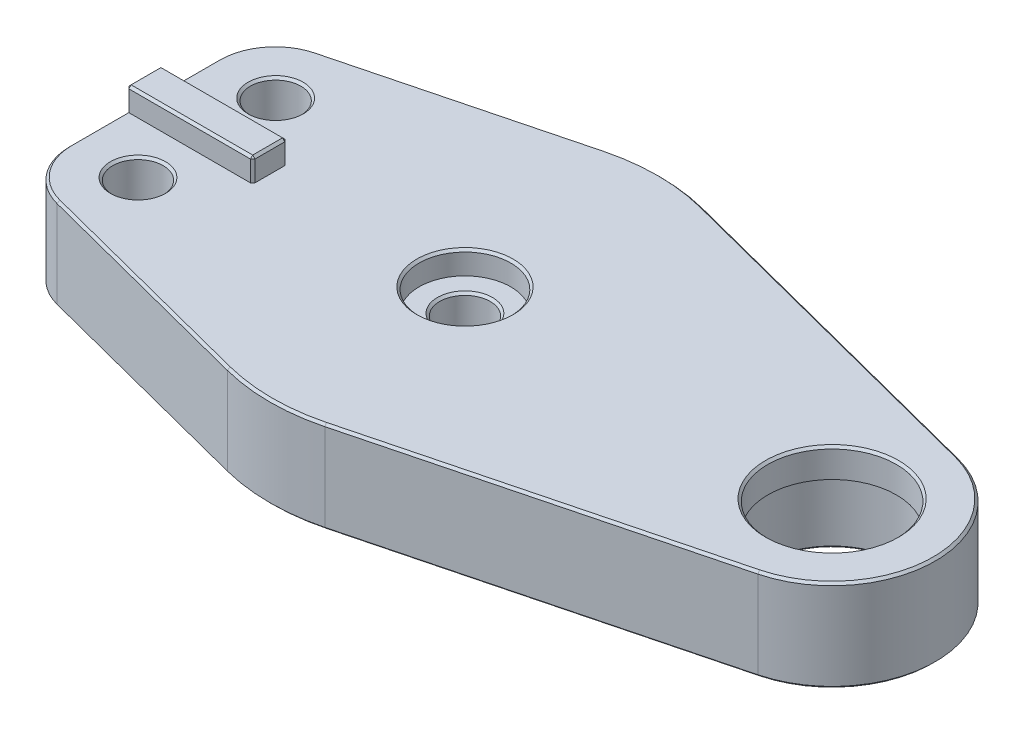
from build123d import *

# Parameters (mm, degrees)
SKETCH_1_R           = 2.1
EXTRUDE_2_DEPTH      = 8
SKETCH_2_R           = 2.2
CUT_EXTRUDE_1_DEPTH  = 20
SKETCH_2_3_R         = 4
SKETCH_2_3_R_2       = 2.2
CUT_EXTRUDE_2_DEPTH  = 2
CUT_EXTRUDE_START    = -8
SKETCH_9_R           = 3
SKETCH_9_R_2         = 2.1
CUT_EXTRUDE_11_DEPTH = 8
SKETCH_10_R          = 5.6
SKETCH_10_R_2        = 3
CUT_EXTRUDE_12_DEPTH = 5.5
SKETCH_10_3_R        = 6
SKETCH_10_3_R_2      = 5.6
CUT_EXTRUDE_13_DEPTH = 5.5
SKETCH_10_4_R        = 5.6
SKETCH_10_4_R_2      = 3
CUT_EXTRUDE_14_DEPTH = 20
CHAMFER_1_SIZE       = 0.2
SKETCH_11_R          = 2.2
EXTRUDE_3_DEPTH      = 8
FILLET_1_R           = 5
SKETCH_12_W          = 11
SKETCH_12_H          = 3
EXTRUDE_5_DEPTH      = 2
CUT_EXTRUDE_START_2  = -2
SKETCH_13_R          = 4
CUT_EXTRUDE_16_DEPTH = 2
CHAMFER_2_SIZE       = 0.2


with BuildPart() as part:
    # 스케치1 → 보스-돌출2 (new body)
    with BuildSketch(Plane(origin=(0, 0, 0), x_dir=(1, 0, 0), z_dir=(0, 1, 0))):
        with BuildLine():
            Line((34.25, 8.714212529), (4.25, 16.460179221))
            ThreePointArc((4.25, 16.460179221), (-17, 0), (4.25, -16.460179221))
            Line((4.25, -16.460179221), (34.25, -8.714212529))
            ThreePointArc((34.25, -8.714212529), (41, 0), (34.25, 8.714212529))
        make_face()
        with Locations(Location((32, 0, 0), (0, 0, 270))):
            Circle(SKETCH_1_R, mode=Mode.SUBTRACT)
    extrude(amount=EXTRUDE_2_DEPTH)

    # 스케치2 → 컷-돌출1 (cut)
    with BuildSketch(Plane(origin=(0, 8, 0), x_dir=(1, 0, 0), z_dir=(0, 1, 0))):
        with Locations(Location((0, 0, 0), (0, 0, 270))):
            Circle(SKETCH_2_R)
    extrude(amount=-CUT_EXTRUDE_1_DEPTH, mode=Mode.SUBTRACT)

    # 스케치2<3> → 컷-돌출2 (cut)
    with BuildSketch(Plane(origin=(0, 8, 0), x_dir=(1, 0, 0), z_dir=(0, 1, 0))):
        with Locations(Location((0, 0, 0), (0, 0, 270))):
            Circle(SKETCH_2_3_R)
        with Locations(Location((0, 0, 0), (0, 0, 270))):
            Circle(SKETCH_2_3_R_2, mode=Mode.SUBTRACT)
    extrude(amount=-CUT_EXTRUDE_2_DEPTH, mode=Mode.SUBTRACT)

    # 스케치9 → 컷-돌출11 (cut)
    with BuildSketch(Plane(origin=(0, 8, 0), x_dir=(1, 0, 0), z_dir=(0, 1, 0)).offset(CUT_EXTRUDE_START)):
        with Locations(Location((32, 0, 0), (0, 0, 270))):
            Circle(SKETCH_9_R)
        with Locations((32, 0)):
            Circle(SKETCH_9_R_2, mode=Mode.SUBTRACT)
    extrude(amount=CUT_EXTRUDE_11_DEPTH, mode=Mode.SUBTRACT)

    # 스케치10 → 컷-돌출12 (cut)
    with BuildSketch(Plane.XZ):
        with Locations(Location((32, 0, 0), (0, 0, 270))):
            Circle(SKETCH_10_R)
        with Locations(Location((32, 0, 0), (0, 0, 90))):
            Circle(SKETCH_10_R_2, mode=Mode.SUBTRACT)
    extrude(amount=-CUT_EXTRUDE_12_DEPTH, mode=Mode.SUBTRACT)

    # 스케치10<3> → 컷-돌출13 (cut)
    with BuildSketch(Plane.XZ):
        with Locations(Location((32, 0, 0), (0, 0, 270))):
            Circle(SKETCH_10_3_R)
        with Locations((32, 0)):
            Circle(SKETCH_10_3_R_2, mode=Mode.SUBTRACT)
    extrude(amount=-CUT_EXTRUDE_13_DEPTH, mode=Mode.SUBTRACT)

    # 스케치10<4> → 컷-돌출14 (cut)
    with BuildSketch(Plane.XZ):
        with Locations(Location((32, 0, 0), (0, 0, 270))):
            Circle(SKETCH_10_4_R)
        with Locations((32, 0)):
            Circle(SKETCH_10_4_R_2, mode=Mode.SUBTRACT)
    extrude(amount=-CUT_EXTRUDE_14_DEPTH, mode=Mode.SUBTRACT)

    # 모따기1
    chamfer_1_edges = [part.edges().sort_by_distance(p)[0] for p in [
        (32, 0, 6),
        (32, 8, 5.6),
    ]]
    chamfer(chamfer_1_edges, length=CHAMFER_1_SIZE)

    # 스케치11 → 보스-돌출3 (add)
    # profile 1 of 3: a face of its own
    with BuildSketch(Plane(origin=(0, 0, 0), x_dir=(1, 0, 0), z_dir=(0, 1, 0))):
        with BuildLine():
            ThreePointArc((-17, 1.7e-08), (-13.43968005, 10.410331414), (-4.25, 16.460179221))
            Line((-4.25, 16.460179221), (-17, 13.168143377))
            Line((-17, 13.168143377), (-17, 1.7e-08))
        make_face()
    # profile 2 of 3: a face of its own
    with BuildSketch(Plane(origin=(0, 0, 0), x_dir=(1, 0, 0), z_dir=(0, 1, 0))):
        with BuildLine():
            ThreePointArc((-4.25, -16.460179221), (-13.439680061, -10.4103314), (-17, 1.7e-08))
            Line((-17, 1.7e-08), (-17, -13.168143377))
            Line((-17, -13.168143377), (-4.25, -16.460179221))
        make_face()
    # profile 3 of 3: a face of its own
    with BuildSketch(Plane(origin=(0, 0, 0), x_dir=(1, 0, 0), z_dir=(0, 1, 0))):
        Polygon((-17, 1.7e-08), (-17, 13.168143377), (-28, 10.32795559), (-28, -10.32795559), (-17, -13.168143377), align=None)
        with Locations(Location((-22.5, -6, 0), (0, 0, 270))):
            Circle(SKETCH_11_R, mode=Mode.SUBTRACT)
        with Locations(Location((-22.5, 6, 0), (0, 0, 270))):
            Circle(SKETCH_11_R, mode=Mode.SUBTRACT)
    extrude(amount=EXTRUDE_3_DEPTH)

    # 필렛1
    fillet_1_edges = [part.edges().sort_by_distance(p)[0] for p in [
        (-28, 4, 10.32795559),
        (-28, 4, -10.32795559),
    ]]
    fillet(fillet_1_edges, radius=FILLET_1_R)

    # 스케치12 → 보스-돌출5 (add)
    with BuildSketch(Plane(origin=(0, 8, 0), x_dir=(1, 0, 0), z_dir=(0, 1, 0))):
        with Locations((-22.5, 0)):
            Rectangle(SKETCH_12_W, SKETCH_12_H)
    extrude(amount=EXTRUDE_5_DEPTH)

    # 스케치13 → 컷-돌출16 (cut)
    with BuildSketch(Plane.XZ.offset(CUT_EXTRUDE_START_2)):
        with Locations(Location((-22.5, 6, 0), (0, 0, 270))):
            Circle(SKETCH_13_R)
        with Locations(Location((-22.5, -6, 0), (0, 0, 270))):
            Circle(SKETCH_13_R)
        with Locations(Location((0, 0, 0), (0, 0, 90))):
            Circle(SKETCH_13_R)
    extrude(amount=CUT_EXTRUDE_16_DEPTH, mode=Mode.SUBTRACT)

    # 모따기2
    chamfer_2_edges = [part.edges().sort_by_distance(p)[0] for p in [
        (-28, 8, -3.977486122),
        (-26.952847075, 8, -9.516834422),
        (-26.952847075, 8, 9.516834422),
        (19.25, 8, -12.587195875),
        (-28, 8, 3.977486122),
        (-17, 9, 1.5),
        (-17, 9, -1.5),
        (-28, 9, -1.5),
        (-28, 9, 1.5),
        (-17, 10, 0),
        (-22.5, 10, -1.5),
        (-28, 10, 0),
        (-22.5, 10, 1.5),
        (0, 0, -4),
        (0, 2, -2.2),
        (-22.5, 2, -8.2),
        (-22.5, 0, -2),
        (-22.5, 2, 3.8),
        (-22.5, 0, 10),
        (0, 8, -17),
        (19.25, 8, 12.587195875),
        (0, 6, -2.2),
        (0, 8, -4),
        (41, 8, 0),
        (19.25, 0, 12.587195875),
        (0, 0, -17),
        (0, 0, 17),
        (0, 8, 17),
        (-22.5, 8, 3.8),
        (-14.25, 0, -13.878190324),
        (19.25, 0, -12.587195875),
        (-22.5, 8, -8.2),
        (-14.25, 8, -13.878190324),
        (41, 0, 0),
        (-14.25, 8, 13.878190324),
        (-14.25, 0, 13.878190324),
        (-28, 0, 0),
        (-26.952847075, 0, -9.516834422),
        (-26.952847075, 0, 9.516834422),
    ]]
    chamfer(chamfer_2_edges, length=CHAMFER_2_SIZE)


solid = part.part
